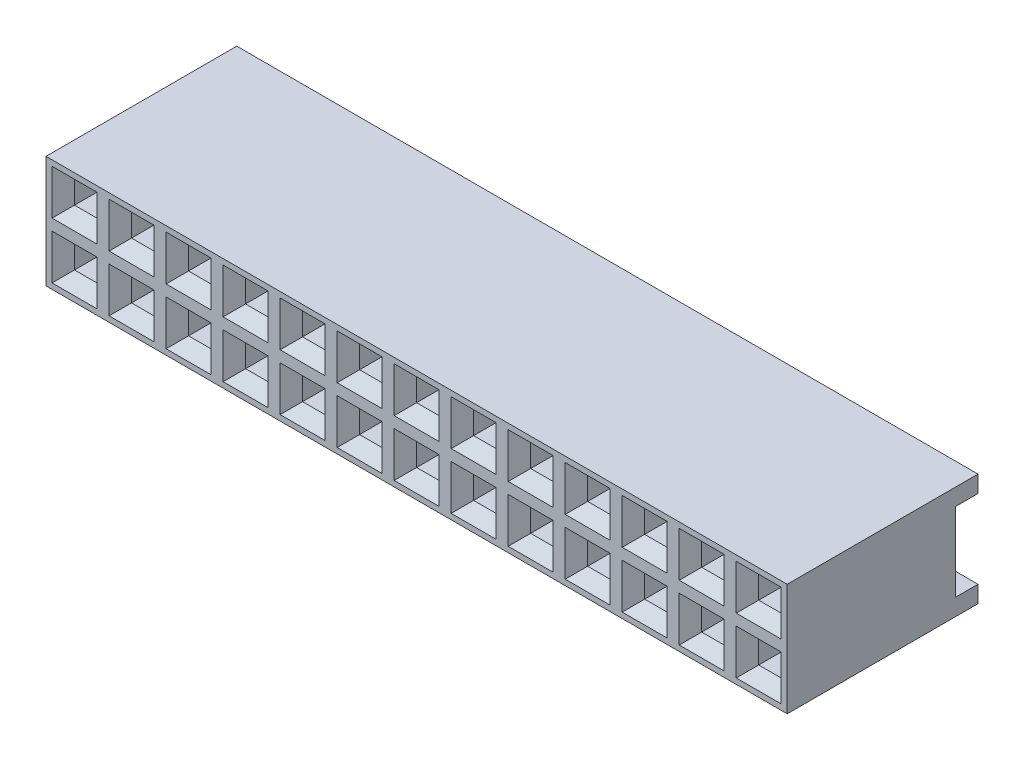
from build123d import *

# Parameters (mm, degrees)
SKETCH1_W           = 33.02
SKETCH1_H           = 5
BOSS_EXTRUDE1_DEPTH = 8.5
SKETCH2_W           = 1
SKETCH2_H           = 1
CUT_EXTRUDE1_DEPTH  = 6
CHAMFER1_SIZE       = 0.5
SKETCH3_W           = 2
SKETCH3_H           = 0.6
CUT_EXTRUDE2_DEPTH  = 6.5
SKETCH4_W           = 33.02
SKETCH4_H           = 3.5
CUT_EXTRUDE3_DEPTH  = 1


with BuildPart() as part:
    # Sketch1 → Boss-Extrude1 (new body)
    with BuildSketch(Plane.XY):
        with Locations((-52.129042009, 16.985991141)):
            Rectangle(SKETCH1_W, SKETCH1_H)
    extrude(amount=BOSS_EXTRUDE1_DEPTH)

    # Sketch2 → Cut-Extrude1 (cut)
    with BuildSketch(Plane.XY.offset(8.5)):
        with Locations((-67.369042009, 18.235991141)):
            Rectangle(SKETCH2_W, SKETCH2_H)
        with Locations((-64.829042009, 18.235991141)):
            Rectangle(SKETCH2_W, SKETCH2_H)
        with Locations((-62.289042009, 18.235991141)):
            Rectangle(SKETCH2_W, SKETCH2_H)
        with Locations((-59.749042009, 18.235991141)):
            Rectangle(SKETCH2_W, SKETCH2_H)
        with Locations((-57.209042009, 18.235991141)):
            Rectangle(SKETCH2_W, SKETCH2_H)
        with Locations((-54.669042009, 18.235991141)):
            Rectangle(SKETCH2_W, SKETCH2_H)
        with Locations((-52.129042009, 18.235991141)):
            Rectangle(SKETCH2_W, SKETCH2_H)
        with Locations((-49.589042009, 18.235991141)):
            Rectangle(SKETCH2_W, SKETCH2_H)
        with Locations((-47.049042009, 18.235991141)):
            Rectangle(SKETCH2_W, SKETCH2_H)
        with Locations((-44.509042009, 18.235991141)):
            Rectangle(SKETCH2_W, SKETCH2_H)
        with Locations((-41.969042009, 18.235991141)):
            Rectangle(SKETCH2_W, SKETCH2_H)
        with Locations((-39.429042009, 18.235991141)):
            Rectangle(SKETCH2_W, SKETCH2_H)
        with Locations((-36.889042009, 18.235991141)):
            Rectangle(SKETCH2_W, SKETCH2_H)
        with Locations((-64.829042009, 15.735991141)):
            Rectangle(SKETCH2_W, SKETCH2_H)
        with Locations((-62.289042009, 15.735991141)):
            Rectangle(SKETCH2_W, SKETCH2_H)
        with Locations((-59.749042009, 15.735991141)):
            Rectangle(SKETCH2_W, SKETCH2_H)
        with Locations((-57.209042009, 15.735991141)):
            Rectangle(SKETCH2_W, SKETCH2_H)
        with Locations((-54.669042009, 15.735991141)):
            Rectangle(SKETCH2_W, SKETCH2_H)
        with Locations((-52.129042009, 15.735991141)):
            Rectangle(SKETCH2_W, SKETCH2_H)
        with Locations((-49.589042009, 15.735991141)):
            Rectangle(SKETCH2_W, SKETCH2_H)
        with Locations((-47.049042009, 15.735991141)):
            Rectangle(SKETCH2_W, SKETCH2_H)
        with Locations((-44.509042009, 15.735991141)):
            Rectangle(SKETCH2_W, SKETCH2_H)
        with Locations((-41.969042009, 15.735991141)):
            Rectangle(SKETCH2_W, SKETCH2_H)
        with Locations((-39.429042009, 15.735991141)):
            Rectangle(SKETCH2_W, SKETCH2_H)
        with Locations((-36.889042009, 15.735991141)):
            Rectangle(SKETCH2_W, SKETCH2_H)
        with Locations((-67.369042009, 15.735991141)):
            Rectangle(SKETCH2_W, SKETCH2_H)
    extrude(amount=-CUT_EXTRUDE1_DEPTH, mode=Mode.SUBTRACT)

    # Chamfer1
    chamfer1_edges = [part.edges().sort_by_distance(p)[0] for p in [
        (-47.049042009, 17.735991141, 8.5),
        (-46.549042009, 18.235991141, 8.5),
        (-47.049042009, 18.735991141, 8.5),
        (-47.549042009, 18.235991141, 8.5),
        (-44.509042009, 17.735991141, 8.5),
        (-44.009042009, 18.235991141, 8.5),
        (-44.509042009, 18.735991141, 8.5),
        (-45.009042009, 18.235991141, 8.5),
        (-41.969042009, 17.735991141, 8.5),
        (-41.469042009, 18.235991141, 8.5),
        (-41.969042009, 18.735991141, 8.5),
        (-42.469042009, 18.235991141, 8.5),
        (-39.429042009, 17.735991141, 8.5),
        (-38.929042009, 18.235991141, 8.5),
        (-39.429042009, 18.735991141, 8.5),
        (-39.929042009, 18.235991141, 8.5),
        (-36.889042009, 17.735991141, 8.5),
        (-36.389042009, 18.235991141, 8.5),
        (-36.889042009, 18.735991141, 8.5),
        (-37.389042009, 18.235991141, 8.5),
        (-64.829042009, 15.235991141, 8.5),
        (-64.329042009, 15.735991141, 8.5),
        (-64.829042009, 16.235991141, 8.5),
        (-65.329042009, 15.735991141, 8.5),
        (-62.289042009, 15.235991141, 8.5),
        (-61.789042009, 15.735991141, 8.5),
        (-62.289042009, 16.235991141, 8.5),
        (-62.789042009, 15.735991141, 8.5),
        (-67.869042009, 18.235991141, 8.5),
        (-67.369042009, 17.735991141, 8.5),
        (-66.869042009, 18.235991141, 8.5),
        (-67.369042009, 18.735991141, 8.5),
        (-59.749042009, 15.235991141, 8.5),
        (-59.249042009, 15.735991141, 8.5),
        (-59.749042009, 16.235991141, 8.5),
        (-60.249042009, 15.735991141, 8.5),
        (-57.209042009, 15.235991141, 8.5),
        (-56.709042009, 15.735991141, 8.5),
        (-57.209042009, 16.235991141, 8.5),
        (-57.709042009, 15.735991141, 8.5),
        (-54.669042009, 15.235991141, 8.5),
        (-54.169042009, 15.735991141, 8.5),
        (-54.669042009, 16.235991141, 8.5),
        (-55.169042009, 15.735991141, 8.5),
        (-52.129042009, 15.235991141, 8.5),
        (-51.629042009, 15.735991141, 8.5),
        (-52.129042009, 16.235991141, 8.5),
        (-52.629042009, 15.735991141, 8.5),
        (-49.589042009, 15.235991141, 8.5),
        (-49.089042009, 15.735991141, 8.5),
        (-49.589042009, 16.235991141, 8.5),
        (-50.089042009, 15.735991141, 8.5),
        (-47.049042009, 15.235991141, 8.5),
        (-46.549042009, 15.735991141, 8.5),
        (-47.049042009, 16.235991141, 8.5),
        (-47.549042009, 15.735991141, 8.5),
        (-44.509042009, 15.235991141, 8.5),
        (-44.009042009, 15.735991141, 8.5),
        (-44.509042009, 16.235991141, 8.5),
        (-45.009042009, 15.735991141, 8.5),
        (-41.969042009, 15.235991141, 8.5),
        (-41.469042009, 15.735991141, 8.5),
        (-41.969042009, 16.235991141, 8.5),
        (-42.469042009, 15.735991141, 8.5),
        (-39.429042009, 15.235991141, 8.5),
        (-38.929042009, 15.735991141, 8.5),
        (-39.429042009, 16.235991141, 8.5),
        (-39.929042009, 15.735991141, 8.5),
        (-36.889042009, 15.235991141, 8.5),
        (-36.389042009, 15.735991141, 8.5),
        (-36.889042009, 16.235991141, 8.5),
        (-37.389042009, 15.735991141, 8.5),
        (-64.829042009, 17.735991141, 8.5),
        (-64.329042009, 18.235991141, 8.5),
        (-64.829042009, 18.735991141, 8.5),
        (-65.329042009, 18.235991141, 8.5),
        (-67.369042009, 15.235991141, 8.5),
        (-66.869042009, 15.735991141, 8.5),
        (-67.369042009, 16.235991141, 8.5),
        (-67.869042009, 15.735991141, 8.5),
        (-62.289042009, 17.735991141, 8.5),
        (-61.789042009, 18.235991141, 8.5),
        (-62.289042009, 18.735991141, 8.5),
        (-62.789042009, 18.235991141, 8.5),
        (-59.749042009, 17.735991141, 8.5),
        (-59.249042009, 18.235991141, 8.5),
        (-59.749042009, 18.735991141, 8.5),
        (-60.249042009, 18.235991141, 8.5),
        (-57.209042009, 17.735991141, 8.5),
        (-56.709042009, 18.235991141, 8.5),
        (-57.209042009, 18.735991141, 8.5),
        (-57.709042009, 18.235991141, 8.5),
        (-54.669042009, 17.735991141, 8.5),
        (-54.169042009, 18.235991141, 8.5),
        (-54.669042009, 18.735991141, 8.5),
        (-55.169042009, 18.235991141, 8.5),
        (-52.129042009, 17.735991141, 8.5),
        (-51.629042009, 18.235991141, 8.5),
        (-52.129042009, 18.735991141, 8.5),
        (-52.629042009, 18.235991141, 8.5),
        (-49.589042009, 17.735991141, 8.5),
        (-49.089042009, 18.235991141, 8.5),
        (-49.589042009, 18.735991141, 8.5),
        (-50.089042009, 18.235991141, 8.5),
    ]]
    chamfer(chamfer1_edges, length=CHAMFER1_SIZE)

    # Sketch3 → Cut-Extrude2 (cut)
    with BuildSketch(Plane(origin=(0, 0, 0), x_dir=(-1, 0, 0), z_dir=(0, 0, -1))):
        with Locations((67.369042009, 15.535991141)):
            Rectangle(SKETCH3_W, SKETCH3_H)
        with Locations((64.829042009, 15.535991141)):
            Rectangle(SKETCH3_W, SKETCH3_H)
        with Locations((62.289042009, 15.535991141)):
            Rectangle(SKETCH3_W, SKETCH3_H)
        with Locations((59.749042009, 15.535991141)):
            Rectangle(SKETCH3_W, SKETCH3_H)
        with Locations((57.209042009, 15.535991141)):
            Rectangle(SKETCH3_W, SKETCH3_H)
        with Locations((54.669042009, 15.535991141)):
            Rectangle(SKETCH3_W, SKETCH3_H)
        with Locations((52.129042009, 15.535991141)):
            Rectangle(SKETCH3_W, SKETCH3_H)
        with Locations((49.589042009, 15.535991141)):
            Rectangle(SKETCH3_W, SKETCH3_H)
        with Locations((47.049042009, 15.535991141)):
            Rectangle(SKETCH3_W, SKETCH3_H)
        with Locations((44.509042009, 15.535991141)):
            Rectangle(SKETCH3_W, SKETCH3_H)
        with Locations((41.969042009, 15.535991141)):
            Rectangle(SKETCH3_W, SKETCH3_H)
        with Locations((39.429042009, 15.535991141)):
            Rectangle(SKETCH3_W, SKETCH3_H)
        with Locations((36.889042009, 15.535991141)):
            Rectangle(SKETCH3_W, SKETCH3_H)
        with Locations((64.829042009, 18.435991141)):
            Rectangle(SKETCH3_W, SKETCH3_H)
        with Locations((62.289042009, 18.435991141)):
            Rectangle(SKETCH3_W, SKETCH3_H)
        with Locations((59.749042009, 18.435991141)):
            Rectangle(SKETCH3_W, SKETCH3_H)
        with Locations((57.209042009, 18.435991141)):
            Rectangle(SKETCH3_W, SKETCH3_H)
        with Locations((54.669042009, 18.435991141)):
            Rectangle(SKETCH3_W, SKETCH3_H)
        with Locations((52.129042009, 18.435991141)):
            Rectangle(SKETCH3_W, SKETCH3_H)
        with Locations((49.589042009, 18.435991141)):
            Rectangle(SKETCH3_W, SKETCH3_H)
        with Locations((47.049042009, 18.435991141)):
            Rectangle(SKETCH3_W, SKETCH3_H)
        with Locations((44.509042009, 18.435991141)):
            Rectangle(SKETCH3_W, SKETCH3_H)
        with Locations((41.969042009, 18.435991141)):
            Rectangle(SKETCH3_W, SKETCH3_H)
        with Locations((39.429042009, 18.435991141)):
            Rectangle(SKETCH3_W, SKETCH3_H)
        with Locations((36.889042009, 18.435991141)):
            Rectangle(SKETCH3_W, SKETCH3_H)
        with Locations((67.369042009, 18.435991141)):
            Rectangle(SKETCH3_W, SKETCH3_H)
    extrude(amount=-CUT_EXTRUDE2_DEPTH, mode=Mode.SUBTRACT)

    # Sketch4 → Cut-Extrude3 (cut)
    with BuildSketch(Plane(origin=(0, 0, 0), x_dir=(-1, 0, 0), z_dir=(0, 0, -1))):
        with Locations((52.129042009, 16.985991141)):
            Rectangle(SKETCH4_W, SKETCH4_H)
    extrude(amount=-CUT_EXTRUDE3_DEPTH, mode=Mode.SUBTRACT)


solid = part.part
